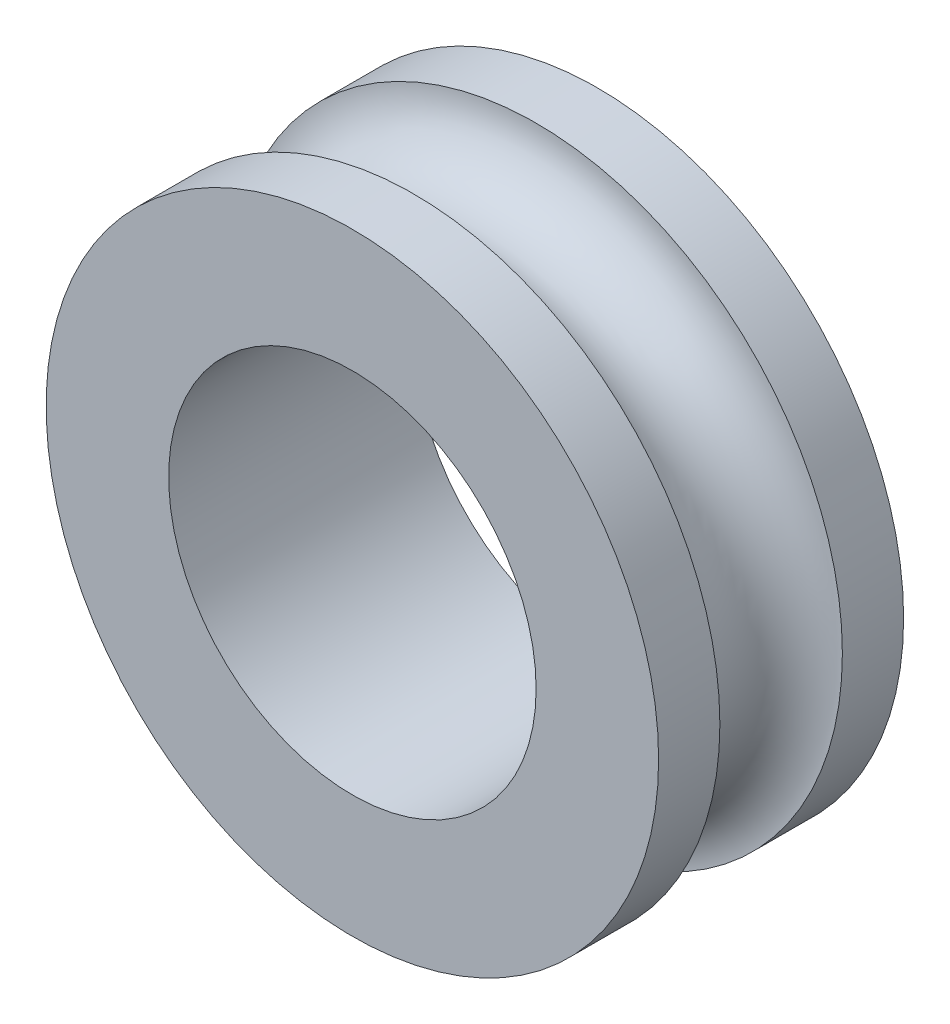
from build123d import *

# Parameters (mm, degrees)
SKETCH1_R           = 5
SKETCH1_R_2         = 3
BOSS_EXTRUDE1_DEPTH = 4


with BuildPart() as part:
    # Sketch1 → Boss-Extrude1 (new body)
    with BuildSketch(Plane.XY):
        Circle(SKETCH1_R)
        Circle(SKETCH1_R_2, mode=Mode.SUBTRACT)
    extrude(amount=BOSS_EXTRUDE1_DEPTH)

    # Sketch2 → Cut-Revolve1 (revolve, cut)
    with BuildSketch(Plane(origin=(0, 0, 0), x_dir=(0, 0, -1), z_dir=(1, 0, 0)), mode=Mode.PRIVATE) as cut_revolve1_sk:
        with BuildLine():
            Line((-3, 5), (-1, 5))
            ThreePointArc((-1, 5), (-2, 4), (-3, 5))
        make_face()
    revolve(cut_revolve1_sk.sketch.rotate(Axis((0, 0, 4), (0, 0, -1)), 90), axis=Axis((0, 0, 4), (0, 0, -1)), mode=Mode.SUBTRACT)


solid = part.part
